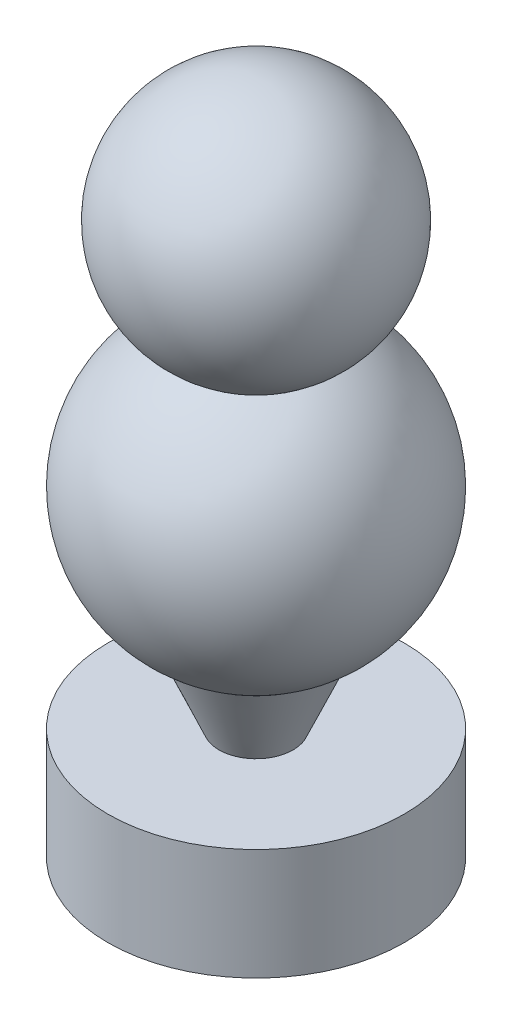
from build123d import *


with BuildPart() as part:
    # Sketch1 → Revolve7 (revolve)
    with BuildSketch(Plane.XY):
        with BuildLine():
            ThreePointArc((5.816712821, -8.134239482), (9.52214248, 3.054308856), (0, 10))
            Line((0, 10), (0, -44.630231668))
            Line((0, -44.630231668), (12, -44.630231668))
            Line((12, -44.630231668), (12, -35.616460888))
            Line((12, -35.616460888), (3, -35.616460888))
            Line((3, -35.616460888), (5.816715231, -29.126222518))
            ThreePointArc((5.816715231, -29.126222518), (12, -18.63023029), (5.816712821, -8.134239482))
        make_face()
    revolve(axis=Axis((0, 10, 0), (0, -1, 0)))


solid = part.part
